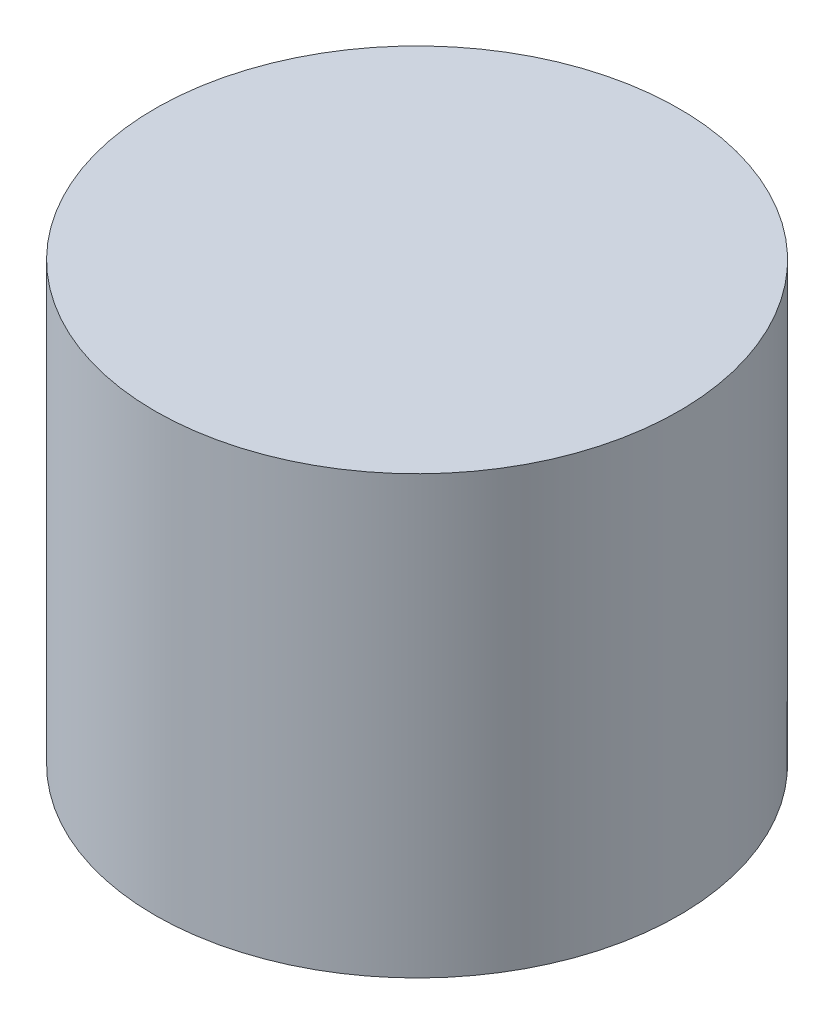
from build123d import *

# Parameters (mm, degrees)
SKETCH1_R           = 15
BOSS_EXTRUDE1_DEPTH = 25


with BuildPart() as part:
    # Sketch1 → Boss-Extrude1 (new body)
    with BuildSketch(Plane(origin=(0, 0, 0), x_dir=(1, 0, 0), z_dir=(0, 1, 0))):
        with Locations(Location((0, 0, 0), (0, 0, 270))):
            Circle(SKETCH1_R)
    extrude(amount=BOSS_EXTRUDE1_DEPTH)


solid = part.part
